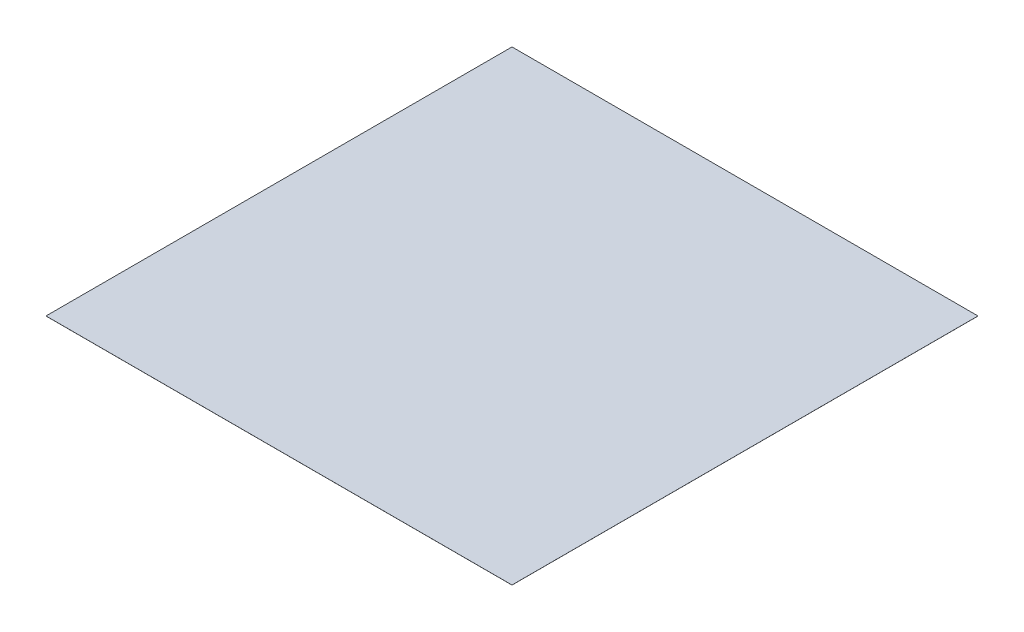
from build123d import *

# Parameters (mm, degrees)
SKETCH1_W           = 65
SKETCH1_H           = 65
BOSS_EXTRUDE1_DEPTH = 0.01


with BuildPart() as part:
    # Sketch1 → Boss-Extrude1 (new body)
    with BuildSketch(Plane(origin=(0, 0, 0), x_dir=(1, 0, 0), z_dir=(0, 1, 0))):
        with Locations((32.5, 32.5)):
            Rectangle(SKETCH1_W, SKETCH1_H)
    extrude(amount=BOSS_EXTRUDE1_DEPTH)


solid = part.part
